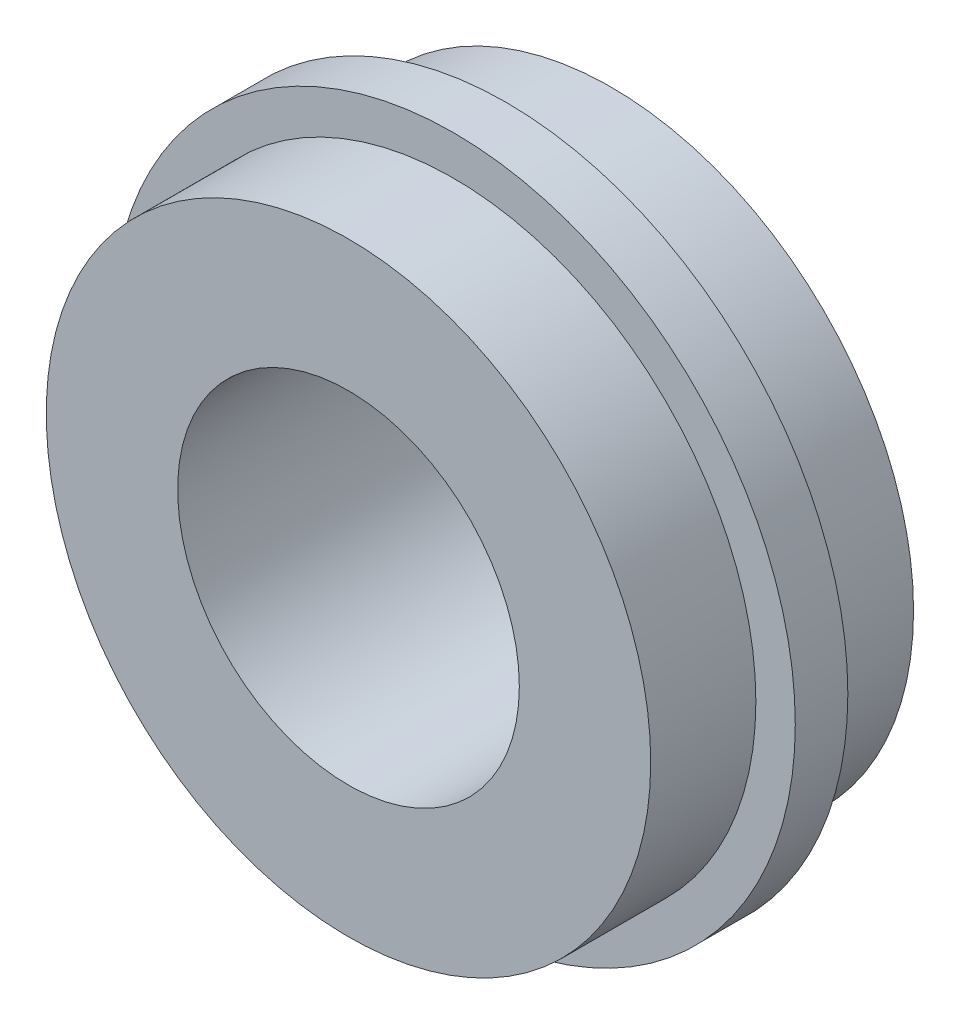
from build123d import *


with BuildPart() as part:
    # 草图1 → 旋转1 (revolve)
    with BuildSketch(Plane(origin=(0, 0, 0), x_dir=(1, 0, 0), z_dir=(0, 1, 0))):
        Polygon((11.5, 5), (11.5, 1), (13, 1), (13, -1), (11.5, -1), (11.5, -5), (6.5, -5), (6.5, 5), align=None)
    revolve(axis=Axis((0, 0, 0), (0, 0, -1)))


solid = part.part
